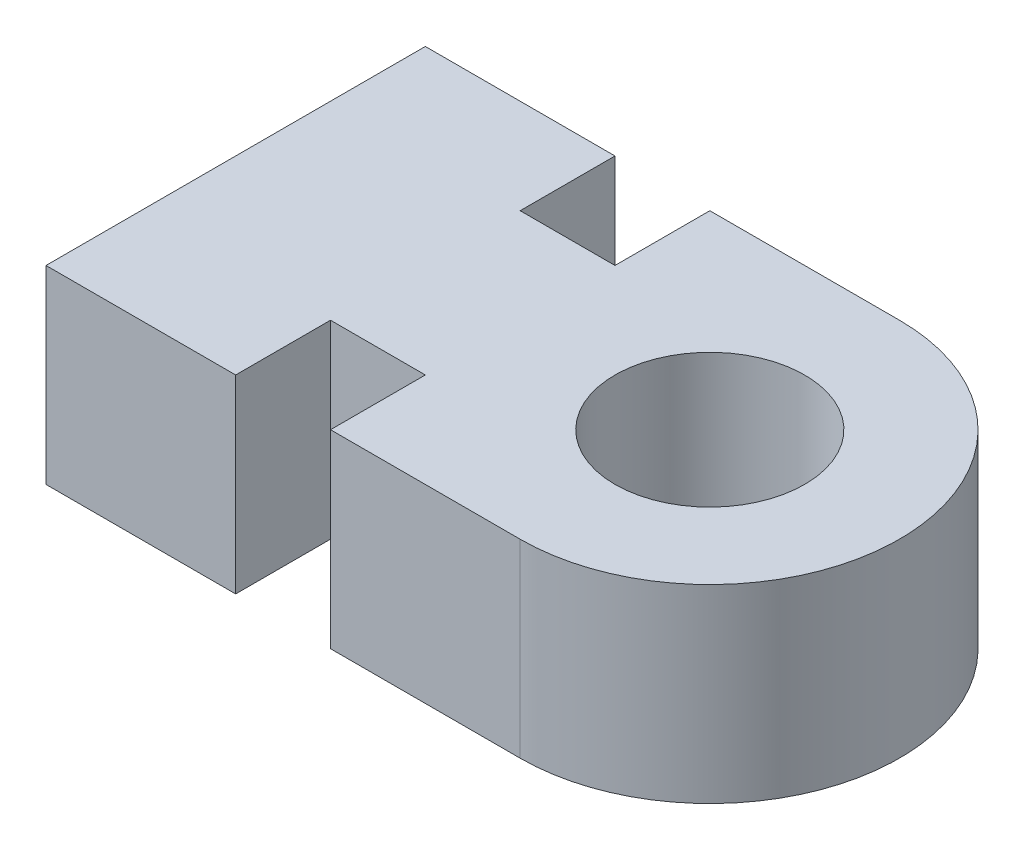
from build123d import *

# Parameters (mm, degrees)
SKETCH_1_R      = 5
EXTRUDE_1_DEPTH = 10


with BuildPart() as part:
    # 草圖1 → 填料-伸長1 (new body)
    with BuildSketch(Plane(origin=(0, 0, 0), x_dir=(1, 0, 0), z_dir=(0, 1, 0))):
        with BuildLine():
            Line((0, 10), (-10, 10))
            Line((-10, 10), (-10, 5))
            Line((-10, 5), (-15, 5))
            Line((-15, 5), (-15, 10))
            Line((-15, 10), (-25, 10))
            Line((-25, 10), (-25, -10))
            Line((-25, -10), (-15, -10))
            Line((-15, -10), (-15, -5))
            Line((-15, -5), (-10, -5))
            Line((-10, -5), (-10, -10))
            Line((-10, -10), (0, -10))
            ThreePointArc((0, -10), (10, 0), (0, 10))
        make_face()
        with Locations(Location((0, 0, 0), (0, 0, 270))):
            Circle(SKETCH_1_R, mode=Mode.SUBTRACT)
    extrude(amount=EXTRUDE_1_DEPTH)


solid = part.part
